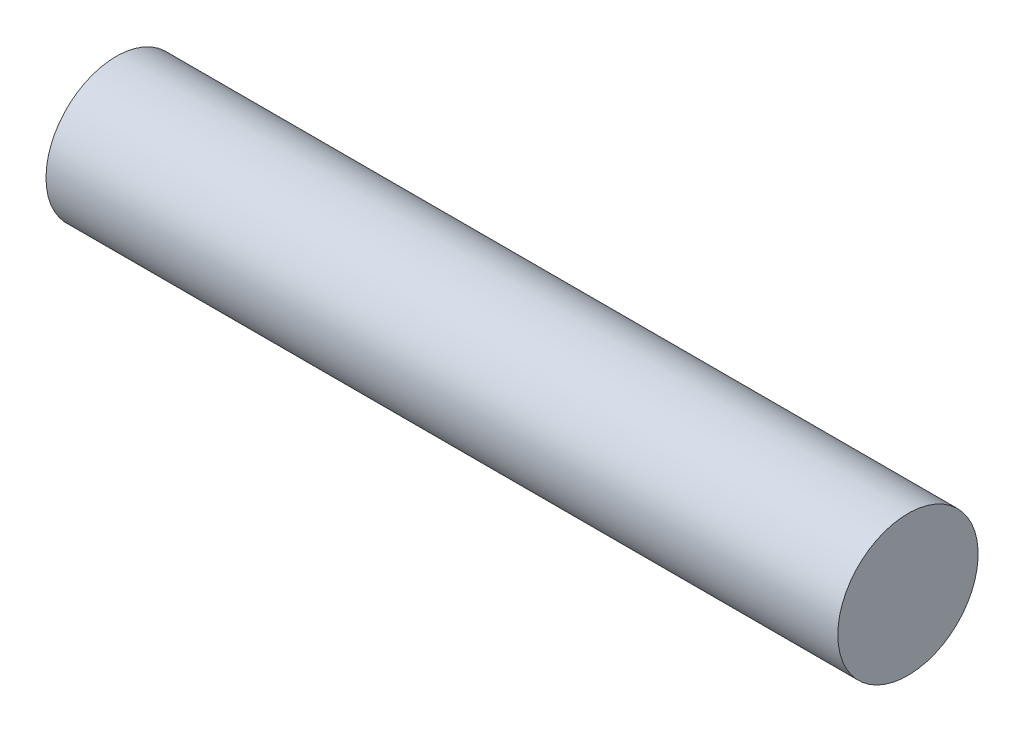
from build123d import *

# Parameters (mm, degrees)
SKETCH_1_W = 79
SKETCH_1_H = 7


with BuildPart() as part:
    # 草图1 → 旋转1 (revolve)
    with BuildSketch(Plane.XY, mode=Mode.PRIVATE) as revolve_1_sk:
        with Locations((39.5, 3.5)):
            Rectangle(SKETCH_1_W, SKETCH_1_H)
    revolve(revolve_1_sk.sketch.rotate(Axis((0, 0, 0), (1, 0, 0)), 90), axis=Axis((0, 0, 0), (1, 0, 0)))


solid = part.part
